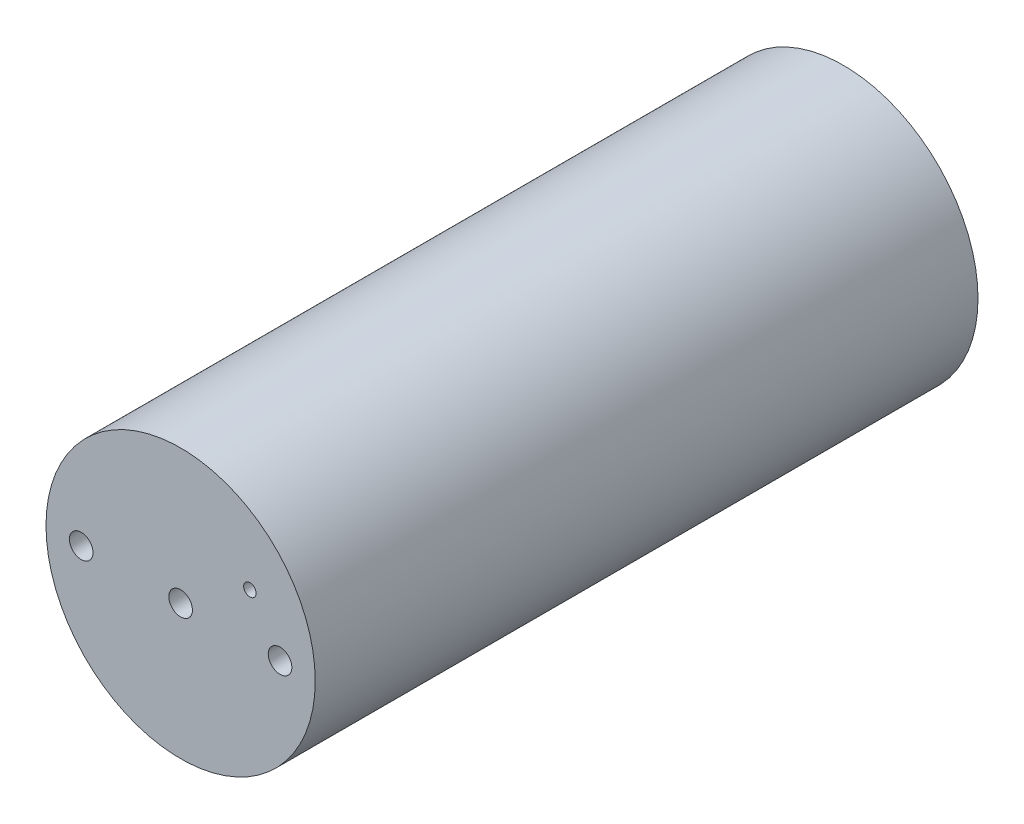
from build123d import *

# Parameters (mm, degrees)
E_BAY_SHELL_R       = 41.275
E_BAY_SHELL_R_2     = 38.1
BOSS_EXTRUDE1_DEPTH = 203.2
LID_TOP_START       = -6.35
SKETCH2_R           = 38.1
SKETCH2_R_2         = 3.6195
SKETCH2_R_3         = 1.905
LID_TOP_DEPTH       = 6.35


with BuildPart() as part:
    # e-bay Shell → Boss-Extrude1 (new body)
    with BuildSketch(Plane.XY):
        Circle(E_BAY_SHELL_R)
        Circle(E_BAY_SHELL_R_2, mode=Mode.SUBTRACT)
    extrude(amount=BOSS_EXTRUDE1_DEPTH)

    # Sketch2 → lid-top (add)
    with BuildSketch(Plane.XY.offset(203.2).offset(LID_TOP_START)):
        Circle(SKETCH2_R)
        Circle(SKETCH2_R_2, mode=Mode.SUBTRACT)
        with Locations((-30.48, 0)):
            Circle(SKETCH2_R_2, mode=Mode.SUBTRACT)
        with Locations((21.231989214, 14.212140166)):
            Circle(SKETCH2_R_3, mode=Mode.SUBTRACT)
        with Locations(Location((30.48, 0, 0), (0, 0, 180))):
            Circle(SKETCH2_R_2, mode=Mode.SUBTRACT)
    lid_top = extrude(amount=LID_TOP_DEPTH)

    # Mirror3: lid-top across plane
    add(lid_top.mirror(Plane.XY.offset(101.6)))


solid = part.part
